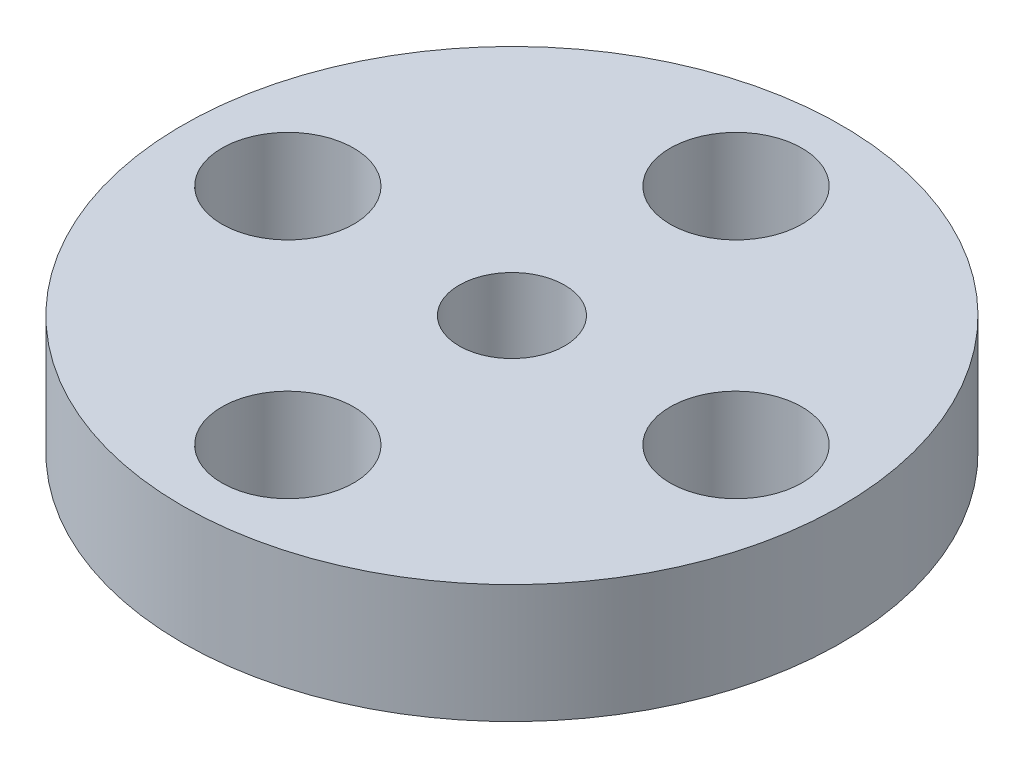
from build123d import *
from build123d.topology import SkipClean

# Parameters (mm, degrees)
SKETCH1_R           = 25
SKETCH1_R_2         = 4
SKETCH1_R_3         = 5
BOSS_EXTRUDE1_DEPTH = 9
BOSS_EXTRUDE2_START = 1
SKETCH2_R           = 6
SKETCH2_R_2         = 4
BOSS_EXTRUDE2_DEPTH = 1


with BuildPart() as part:
    # Sketch1 → Boss-Extrude1 (new body)
    with BuildSketch(Plane(origin=(0, 0, 0), x_dir=(1, 0, 0), z_dir=(0, 1, 0))):
        with Locations(Location((0, 0, 0), (0, 0, 270))):
            Circle(SKETCH1_R)
        with Locations(Location((0, 0, 0), (0, 0, 270))):
            Circle(SKETCH1_R_2, mode=Mode.SUBTRACT)
        with Locations(Location((0, 17, 0), (0, 0, 270))):
            Circle(SKETCH1_R_3, mode=Mode.SUBTRACT)
        with Locations(Location((17, 0, 0), (0, 0, 270))):
            Circle(SKETCH1_R_3, mode=Mode.SUBTRACT)
        with Locations(Location((0, -17, 0), (0, 0, 270))):
            Circle(SKETCH1_R_3, mode=Mode.SUBTRACT)
        with Locations(Location((-17, 0, 0), (0, 0, 270))):
            Circle(SKETCH1_R_3, mode=Mode.SUBTRACT)
    extrude(amount=BOSS_EXTRUDE1_DEPTH)

    # Sketch2 → Boss-Extrude2 (add)
    with SkipClean():  # the faces are left unmerged after this step: merging them gives an invalid solid
        with BuildSketch(Plane(origin=(0, 0, 0), x_dir=(-1, 0, 0), z_dir=(0, -1, 0)).offset(BOSS_EXTRUDE2_START)):
            with Locations(Location((0, 0, 0), (0, 0, 270))):
                Circle(SKETCH2_R)
            with Locations(Location((0, 0, 0), (0, 0, 90))):
                Circle(SKETCH2_R_2, mode=Mode.SUBTRACT)
        extrude(amount=-BOSS_EXTRUDE2_DEPTH)


solid = part.part
